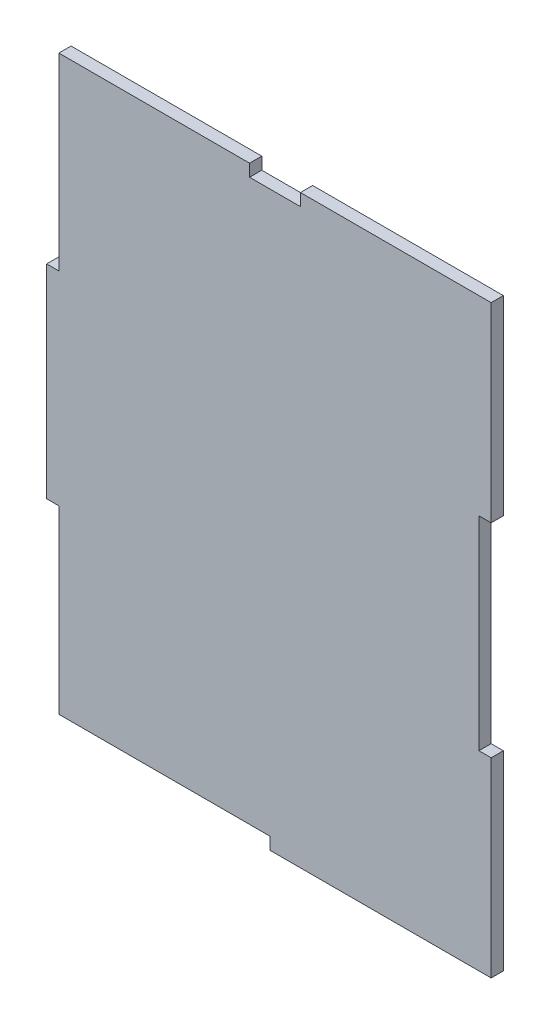
from build123d import *

# Parameters (mm, degrees)
P_IDAT_VYSUNUT_M1_DEPTH = 2.4


with BuildPart() as part:
    # Skica1 → Přidat vysunutím1 (new body)
    with BuildSketch(Plane.XY):
        Polygon((1.683445693, 36.29141573), (1.683445693, 0.79141573), (43.183445693, 0.79141573), (43.183445693, -1.60858427), (86.683445693, -1.60858427), (86.683445693, 35.89141573), (84.283445693, 35.89141573), (84.283445693, 75.89141573), (86.683445693, 75.89141573), (86.683445693, 113.39141573), (49.183445693, 113.39141573), (49.183445693, 110.99141573), (39.183445693, 110.99141573), (39.183445693, 113.39141573), (1.683445693, 113.39141573), (1.683445693, 76.29141573), (-0.716554307, 76.29141573), (-0.716554307, 36.29141573), align=None)
    extrude(amount=P_IDAT_VYSUNUT_M1_DEPTH)


solid = part.part
